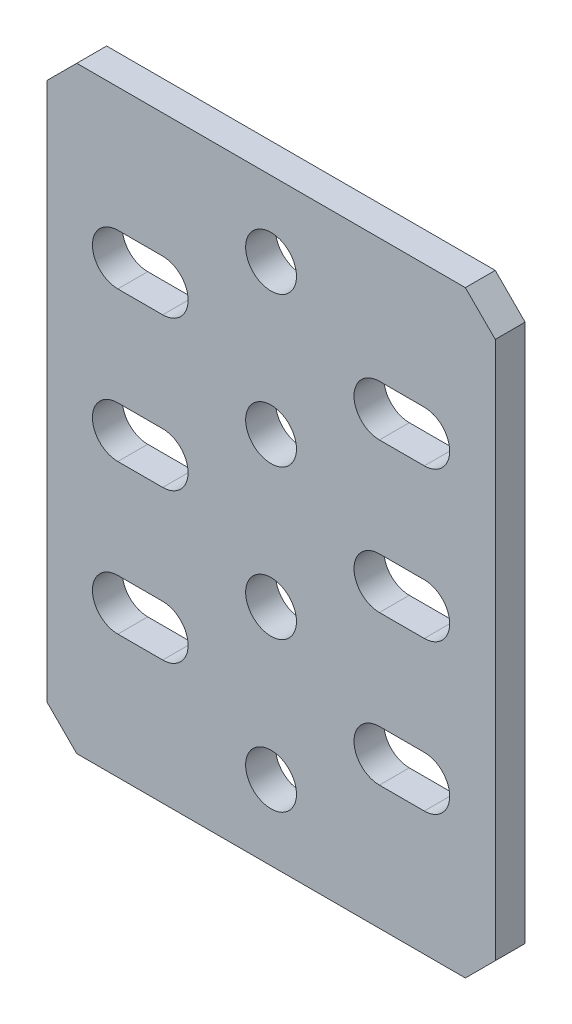
from build123d import *

# Parameters (mm, degrees)
SKETCH1_R           = 1.7
BOSS_EXTRUDE1_DEPTH = 2


with BuildPart() as part:
    # Sketch1 → Boss-Extrude1 (new body)
    with BuildSketch(Plane(origin=(0, 0, 0), x_dir=(-1, 0, 0), z_dir=(0, 0, -1))):
        Polygon((13, -20), (15, -18), (15, 18), (13, 20), (-13, 20), (-15, 18), (-15, -18), (-13, -20), align=None)
        with Locations(Location((0, -15, 0), (0, 0, 180))):
            Circle(SKETCH1_R, mode=Mode.SUBTRACT)
        with Locations(Location((0, -5, 0), (0, 0, 180))):
            Circle(SKETCH1_R, mode=Mode.SUBTRACT)
        with Locations(Location((0, 15, 0), (0, 0, 180))):
            Circle(SKETCH1_R, mode=Mode.SUBTRACT)
        with Locations(Location((0, 5, 0), (0, 0, 180))):
            Circle(SKETCH1_R, mode=Mode.SUBTRACT)
        with BuildLine():
            Line((-10.25, -8.3), (-7.25, -8.3))
            ThreePointArc((-7.25, -8.3), (-5.55, -10), (-7.25, -11.7))
            Line((-7.25, -11.7), (-10.25, -11.7))
            ThreePointArc((-10.25, -11.7), (-11.95, -10), (-10.25, -8.3))
        make_face(mode=Mode.SUBTRACT)
        with BuildLine():
            Line((7.25, -8.3), (10.25, -8.3))
            ThreePointArc((10.25, -8.3), (11.95, -10), (10.25, -11.7))
            Line((10.25, -11.7), (7.25, -11.7))
            ThreePointArc((7.25, -11.7), (5.55, -10), (7.25, -8.3))
        make_face(mode=Mode.SUBTRACT)
        with BuildLine():
            Line((-10.25, 1.7), (-7.25, 1.7))
            ThreePointArc((-7.25, 1.7), (-5.55, 0), (-7.25, -1.7))
            Line((-7.25, -1.7), (-10.25, -1.7))
            ThreePointArc((-10.25, -1.7), (-11.95, 0), (-10.25, 1.7))
        make_face(mode=Mode.SUBTRACT)
        with BuildLine():
            Line((7.25, 1.7), (10.25, 1.7))
            ThreePointArc((10.25, 1.7), (11.95, 0), (10.25, -1.7))
            Line((10.25, -1.7), (7.25, -1.7))
            ThreePointArc((7.25, -1.7), (5.55, 0), (7.25, 1.7))
        make_face(mode=Mode.SUBTRACT)
        with BuildLine():
            Line((10.25, 8.3), (7.25, 8.3))
            ThreePointArc((7.25, 8.3), (5.55, 10), (7.25, 11.7))
            Line((7.25, 11.7), (10.25, 11.7))
            ThreePointArc((10.25, 11.7), (11.95, 10), (10.25, 8.3))
        make_face(mode=Mode.SUBTRACT)
        with BuildLine():
            Line((-7.25, 8.3), (-10.25, 8.3))
            ThreePointArc((-10.25, 8.3), (-11.95, 10), (-10.25, 11.7))
            Line((-10.25, 11.7), (-7.25, 11.7))
            ThreePointArc((-7.25, 11.7), (-5.55, 10), (-7.25, 8.3))
        make_face(mode=Mode.SUBTRACT)
    extrude(amount=-BOSS_EXTRUDE1_DEPTH)


solid = part.part
